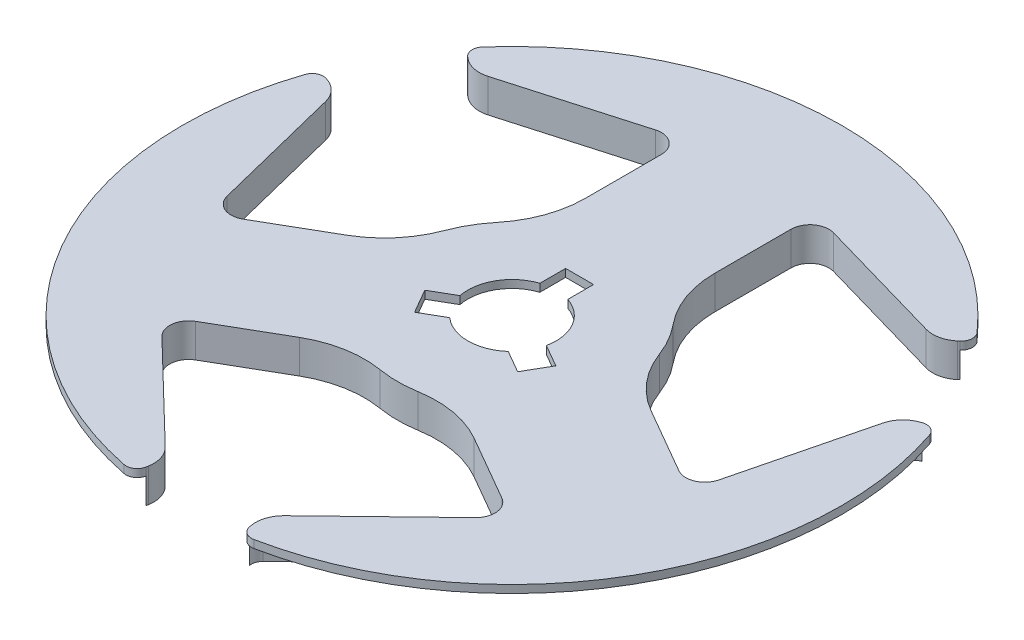
from build123d import *

# Parameters (mm, degrees)
SKETCH1_R           = 2.4003
BOSS_EXTRUDE1_DEPTH = 0.1778
CIRPATTERN1_COUNT   = 3
SKETCH2_R           = 1.0033
CUT_EXTRUDE3_DEPTH  = 11.598193754
CIRPATTERN2_COUNT   = 3
FILLET1_R           = 2.54
BOSS_EXTRUDE2_START = -0.762
BOSS_EXTRUDE2_DEPTH = 0.762
CIRPATTERN3_COUNT   = 3


with BuildPart() as part:
    # Sketch1 → Boss-Extrude1 (new body)
    with BuildSketch(Plane(origin=(0, 0, 0), x_dir=(1, 0, 0), z_dir=(0, 1, 0))):
        with BuildLine():
            ThreePointArc((-2.080029721, 5.48099038), (-1.52284746, 5.377722752), (-1.27, 4.870589203))
            Line((-1.27, 4.870589203), (-1.27, 2.036796526))
            ThreePointArc((-1.27, 2.036796526), (0, 2.4003), (1.27, 2.036796526))
            Line((1.27, 2.036796526), (1.27, 4.870589203))
            ThreePointArc((1.27, 4.870589203), (1.52284746, 5.377722752), (2.080029721, 5.48099038))
            Line((2.080029721, 5.48099038), (5.363123917, 4.539578268))
            ThreePointArc((5.363123917, 4.539578268), (5.647788598, 4.647944118), (5.62377215, 4.951589221))
            ThreePointArc((5.62377215, 4.951589221), (0, 7.493), (-5.62377215, 4.951589221))
            ThreePointArc((-5.62377215, 4.951589221), (-5.647788598, 4.647944118), (-5.363123917, 4.539578268))
            Line((-5.363123917, 4.539578268), (-2.080029721, 5.48099038))
        make_face()
        Circle(SKETCH1_R)
    boss_extrude1 = extrude(amount=BOSS_EXTRUDE1_DEPTH)

    # CirPattern1: Boss-Extrude1 ×3 about axis
    cirpattern1_axis = Axis((0, 0, 0), (0, 1, 0))
    for i in range(1, CIRPATTERN1_COUNT):
        add(boss_extrude1.rotate(cirpattern1_axis, i * 360 / CIRPATTERN1_COUNT))

    # Sketch2 → Cut-Extrude3 (cut, through all)
    with BuildSketch(Plane(origin=(0, 0.1778, 0), x_dir=(1, 0, 0), z_dir=(0, 1, 0))):
        Circle(SKETCH2_R)
        with BuildLine():
            Line((0.3175, 0.951737695), (0.3175, 1.5367))
            Line((0.3175, 1.5367), (-0.3175, 1.5367))
            Line((-0.3175, 1.5367), (-0.3175, 0.951737695))
            ThreePointArc((-0.3175, 0.951737695), (0, 1.0033), (0.3175, 0.951737695))
        make_face()
    cut_extrude3 = extrude(amount=-CUT_EXTRUDE3_DEPTH, mode=Mode.SUBTRACT)

    # CirPattern2: Cut-Extrude3 ×3 about axis
    cirpattern2_axis = Axis((0, 0, 0), (0, 1, 0))
    for i in range(1, CIRPATTERN2_COUNT):
        add(cut_extrude3.rotate(cirpattern2_axis, i * 360 / CIRPATTERN2_COUNT), mode=Mode.SUBTRACT)

    # Fillet1
    fillet1_edges = [part.edges().sort_by_distance(p)[0] for p in [
        (1.27, 0.0889, -2.036796526),
        (-1.27, 0.0889, -2.036796526),
        (2.398917534, 0.0889, -0.081454),
        (-1.128917534, 0.0889, 2.118250526),
        (-2.398917534, 0.0889, -0.081454),
        (1.128917534, 0.0889, 2.118250526),
    ]]
    fillet(fillet1_edges, radius=FILLET1_R)

    # Sketch3 → Boss-Extrude2 (add)
    with BuildSketch(Plane(origin=(0, 0.1778, 0), x_dir=(1, 0, 0), z_dir=(0, 1, 0)).offset(BOSS_EXTRUDE2_START)):
        with BuildLine():
            Line((-4.980841253, 4.437807212), (-2.02402021, 5.285662003))
            ThreePointArc((-2.02402021, 5.285662003), (-1.645136273, 5.215440016), (-1.4732, 4.870589203))
            Line((-1.4732, 4.870589203), (-1.4732, 3.144910824))
            ThreePointArc((-1.4732, 3.144910824), (-1.610918341, 2.354547555), (-2.007840617, 1.65734375))
            ThreePointArc((-2.007840617, 1.65734375), (-2.254697139, 1.30175), (-2.439222099, 0.910169106))
            ThreePointArc((-2.439222099, 0.910169106), (-2.844557167, 0.217822429), (-3.460172666, -0.296626787))
            Line((-3.460172666, -0.296626787), (-4.954653981, -1.159465976))
            ThreePointArc((-4.954653981, -1.159465976), (-5.339271682, -1.182990203), (-5.589527676, -0.889978082))
            Line((-5.589527676, -0.889978082), (-6.33367441, 2.094631451))
            ThreePointArc((-6.33367441, 2.094631451), (-6.478847097, 2.366941647), (-6.73524563, 2.538661605))
            Line((-6.73524563, 2.538661605), (-6.773580549, 2.552424483))
            ThreePointArc((-6.773580549, 2.552424483), (-6.671021136, 2.4837365), (-6.612952061, 2.374812422))
            Line((-6.612952061, 2.374812422), (-5.786691767, -0.939136611))
            ThreePointArc((-5.786691767, -0.939136611), (-5.418668247, -1.370036789), (-4.853053981, -1.335442339))
            Line((-4.853053981, -1.335442339), (-3.358572666, -0.472603149))
            ThreePointArc((-3.358572666, -0.472603149), (-2.689425385, 0.086580782), (-2.248843789, 0.839131517))
            ThreePointArc((-2.248843789, 0.839131517), (-2.078720777, 1.20015), (-1.851131105, 1.527990092))
            ThreePointArc((-1.851131105, 1.527990092), (-1.419693849, 2.285820314), (-1.27, 3.144910824))
            Line((-1.27, 3.144910824), (-1.27, 4.870589203))
            ThreePointArc((-1.27, 4.870589203), (-1.52284746, 5.377722752), (-2.080029721, 5.48099038))
            Line((-2.080029721, 5.48099038), (-5.363123917, 4.539578268))
            ThreePointArc((-5.363123917, 4.539578268), (-5.486489473, 4.535405523), (-5.597254718, 4.589880588))
            Line((-5.597254718, 4.589880588), (-5.566168256, 4.563563014))
            ThreePointArc((-5.566168256, 4.563563014), (-5.289255144, 4.42737535), (-4.980841253, 4.437807212))
        make_face()
    boss_extrude2 = extrude(amount=BOSS_EXTRUDE2_DEPTH)

    # CirPattern3: Boss-Extrude2 ×3 about axis
    cirpattern3_axis = Axis((0, 0, 0), (0, 1, 0))
    for i in range(1, CIRPATTERN3_COUNT):
        add(boss_extrude2.rotate(cirpattern3_axis, i * 360 / CIRPATTERN3_COUNT))


solid = part.part
